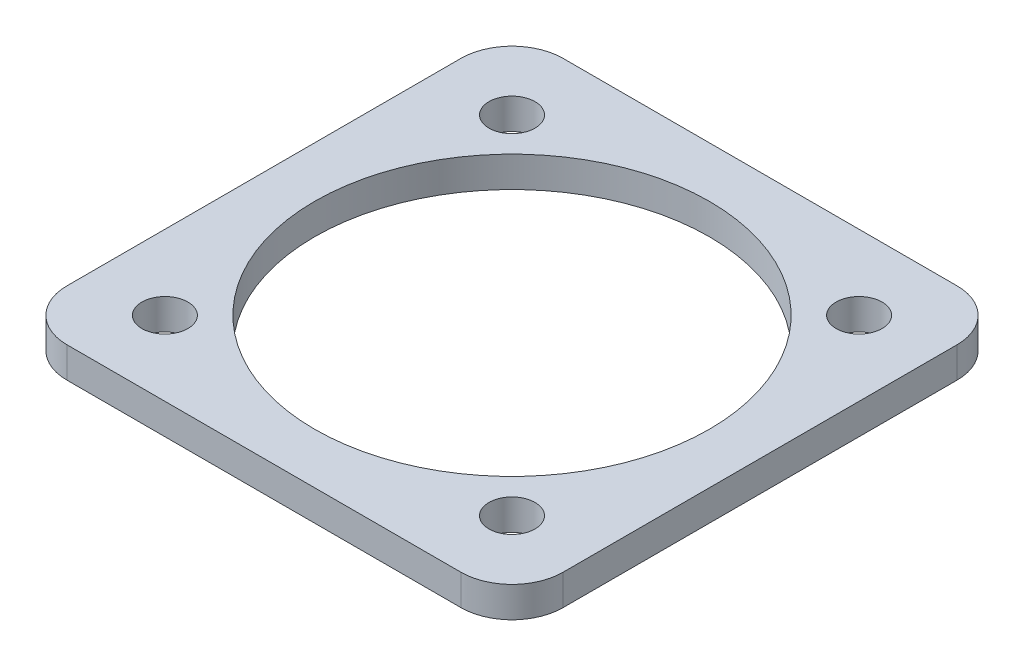
from build123d import *

# Parameters (mm, degrees)
SKETCH_1_R      = 19.3
SKETCH_1_R_2    = 2.25
EXTRUDE_1_DEPTH = 3


with BuildPart() as part:
    # 草图1 → 凸台-拉伸1 (new body)
    with BuildSketch(Plane(origin=(0, 0, 0), x_dir=(1, 0, 0), z_dir=(0, 1, 0))):
        with BuildLine():
            Line((-19.253762595, -24.253762595), (19.253762595, -24.253762595))
            ThreePointArc((19.253762595, -24.253762595), (22.789296501, -22.789296501), (24.253762595, -19.253762595))
            Line((24.253762595, -19.253762595), (24.253762595, 19.253762595))
            ThreePointArc((24.253762595, 19.253762595), (22.789296501, 22.789296501), (19.253762595, 24.253762595))
            Line((19.253762595, 24.253762595), (-19.253762595, 24.253762595))
            ThreePointArc((-19.253762595, 24.253762595), (-22.789296501, 22.789296501), (-24.253762595, 19.253762595))
            Line((-24.253762595, 19.253762595), (-24.253762595, -19.253762595))
            ThreePointArc((-24.253762595, -19.253762595), (-22.789296501, -22.789296501), (-19.253762595, -24.253762595))
        make_face()
        with Locations(Location((0, 0, 0), (0, 0, 270))):
            Circle(SKETCH_1_R, mode=Mode.SUBTRACT)
        with Locations(Location((-16.970562748, 16.970562748, 0), (0, 0, 270))):
            Circle(SKETCH_1_R_2, mode=Mode.SUBTRACT)
        with Locations(Location((16.970562748, 16.970562748, 0), (0, 0, 270))):
            Circle(SKETCH_1_R_2, mode=Mode.SUBTRACT)
        with Locations(Location((16.970562748, -16.970562748, 0), (0, 0, 270))):
            Circle(SKETCH_1_R_2, mode=Mode.SUBTRACT)
        with Locations(Location((-16.970562748, -16.970562748, 0), (0, 0, 270))):
            Circle(SKETCH_1_R_2, mode=Mode.SUBTRACT)
    extrude(amount=EXTRUDE_1_DEPTH)


solid = part.part
